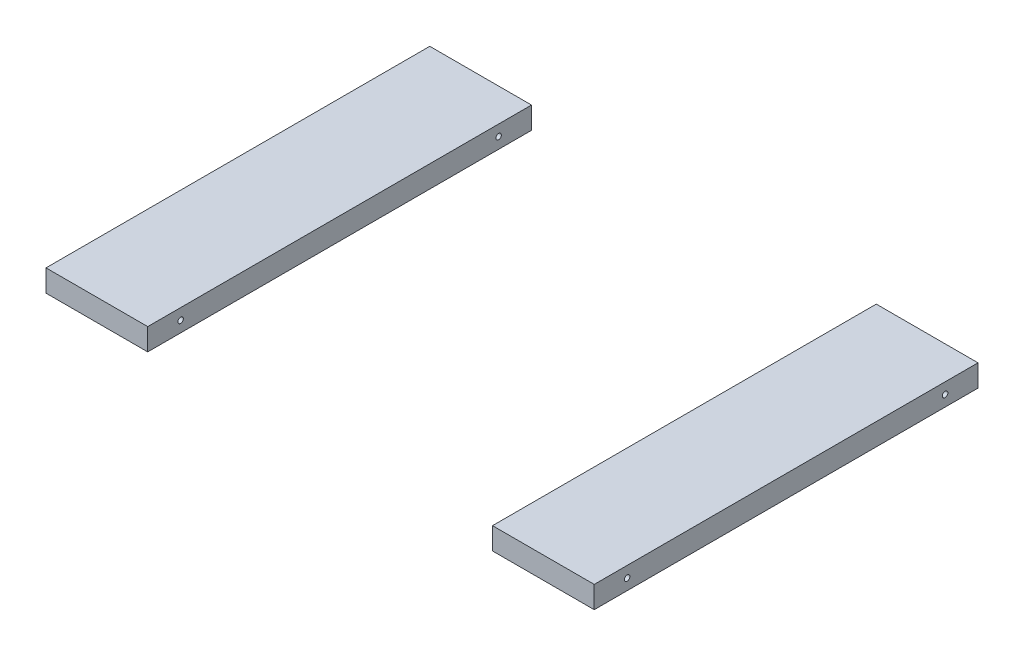
from build123d import *

# Parameters (mm, degrees)
SKETCH1_W           = 500
SKETCH1_H           = 350
BOSS_EXTRUDE1_DEPTH = 20
SKETCH2_W           = 314.448097146
SKETCH2_H           = 350
CUT_EXTRUDE1_DEPTH  = 306.818573667
SKETCH4_R           = 2.5
CUT_EXTRUDE2_DEPTH  = 531.117911412


with BuildPart() as part:
    # Sketch1 → Boss-Extrude1 (new body)
    with BuildSketch(Plane(origin=(0, 0, 0), x_dir=(1, 0, 0), z_dir=(0, 1, 0))):
        Rectangle(SKETCH1_W, SKETCH1_H)
    extrude(amount=BOSS_EXTRUDE1_DEPTH)

    # Sketch2 → Cut-Extrude1 (cut, through all)
    with BuildSketch(Plane(origin=(0, 20, 0), x_dir=(1, 0, 0), z_dir=(0, 1, 0))):
        Rectangle(SKETCH2_W, SKETCH2_H)
    extrude(amount=-CUT_EXTRUDE1_DEPTH, mode=Mode.SUBTRACT)


with BuildPart() as cut_extrude1_piece_1:
    # of the separate pieces the step leaves, piece 1, a body of its own (cut_extrude1_pieces)
    add(part.part.solids().sort_by_distance((157.224048573, 0, -175))[0])


with BuildPart() as cut_extrude1_piece_2:
    # of the separate pieces the step leaves, piece 2, a body of its own (cut_extrude1_pieces)
    add(part.part.solids().sort_by_distance((-250, 0, -175))[0])


with BuildPart() as cut_extrude2_tool:
    # Sketch4 → Cut-Extrude2 (new, through all)
    with BuildSketch(Plane(origin=(250, 0, 0), x_dir=(0, 0, -1), z_dir=(1, 0, 0))):
        with Locations((-145, 10)):
            Circle(SKETCH4_R)
        with Locations((145, 10)):
            Circle(SKETCH4_R)
    extrude(amount=-CUT_EXTRUDE2_DEPTH)


with BuildPart() as cut_extrude1_piece_1_1:
    add(cut_extrude1_piece_1.part)

    # Cut-Extrude2: cut by cut_extrude2_tool
    add(cut_extrude2_tool.part, mode=Mode.SUBTRACT)


with BuildPart() as cut_extrude1_piece_2_1:
    add(cut_extrude1_piece_2.part)

    # Cut-Extrude2: cut by cut_extrude2_tool
    add(cut_extrude2_tool.part, mode=Mode.SUBTRACT)


solid = Compound([cut_extrude1_piece_1_1.part, cut_extrude1_piece_2_1.part])
